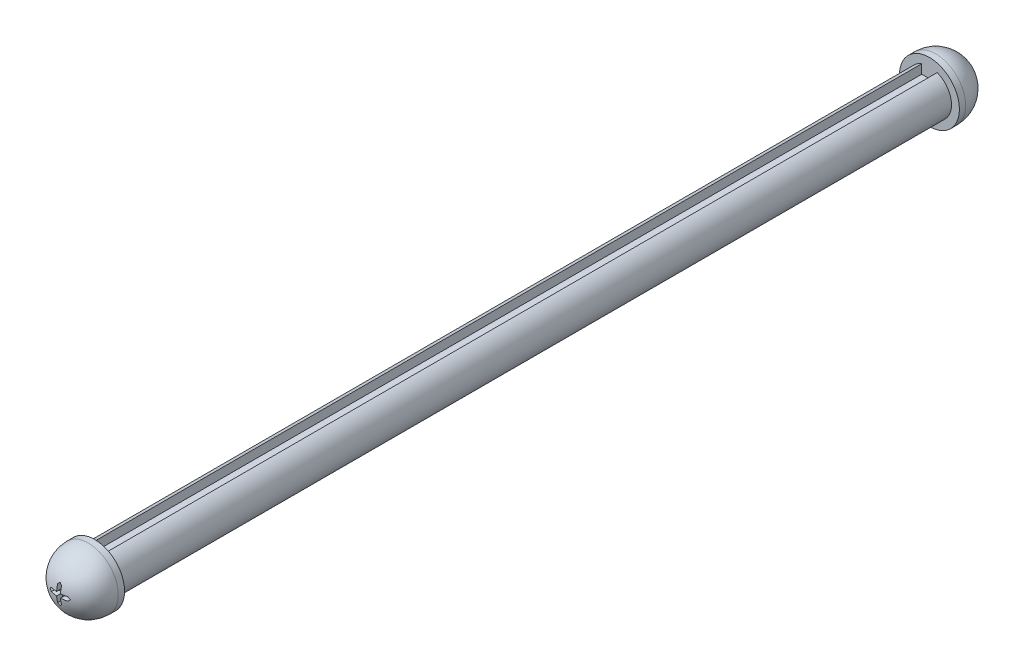
from build123d import *

# Parameters (mm, degrees)
BOSS_EXTRUDE1_DEPTH  = 132.4
SKETCH3_R            = 4.75
BOSS_EXTRUDE2_DEPTH  = 1
CUT_EXTRUDE1_DEPTH   = 1
CUT_EXTRUDE1_DRAFT   = 1
MIRROR1_COPY_1_DEPTH = 1
MIRROR1_COPY_1_DRAFT = 1


with BuildPart() as part:
    # Sketch2 → Boss-Extrude1 (new body)
    with BuildSketch(Plane.XY):
        with BuildLine():
            Line((-1.225, 1.828623949), (1.225, 1.828623949))
            Line((1.225, 1.828623949), (1.225, 3.278623949))
            ThreePointArc((1.225, 3.278623949), (0, -3.5), (-1.225, 3.278623949))
            Line((-1.225, 3.278623949), (-1.225, 1.828623949))
        make_face()
    extrude(amount=BOSS_EXTRUDE1_DEPTH)

    # Sketch3 → Boss-Extrude2 (add)
    with BuildSketch(Plane(origin=(0, 0, 0), x_dir=(-1, 0, 0), z_dir=(0, 0, -1))):
        Circle(SKETCH3_R)
    boss_extrude2 = extrude(amount=BOSS_EXTRUDE2_DEPTH)

    # Sketch4 → Revolve1 (revolve)
    with BuildSketch(Plane(origin=(0, 0, 0), x_dir=(1, 0, 0), z_dir=(0, 1, 0))):
        with BuildLine():
            Line((0, 1), (4.75, 1))
            ThreePointArc((4.75, 1), (3.358757211, 4.358757211), (0, 5.75))
            Line((0, 5.75), (0, 1))
        make_face()
    revolve1 = revolve(axis=Axis((0, 0, -5.75), (0, 0, 1)))


with BuildPart() as cut_extrude1_tool:
    # Sketch5 → Cut-Extrude1 (with draft: the straight prism first)
    with BuildSketch(Plane(origin=(0, 0, -5.75), x_dir=(-1, 0, 0), z_dir=(0, 0, -1))):
        Polygon((0, 1.6), (-0.3, 1.3), (-0.3, 0.3), (-1.3, 0.3), (-1.6, 0), (-1.3, -0.3), (-0.3, -0.3), (-0.3, -1.3), (0, -1.6), (0.3, -1.3), (0.3, -0.3), (1.3, -0.3), (1.6, 0), (1.3, 0.3), (0.3, 0.3), (0.3, 1.3), align=None)
    extrude(amount=-CUT_EXTRUDE1_DEPTH)
    # Cut-Extrude1: the draft: its side faces are tilted about the plane it starts from
    cut_extrude1_sides = [cut_extrude1_tool.faces().sort_by_distance(p)[0] for p in [
        (0.15, 1.45, -5.25),
        (0.3, 0.8, -5.25),
        (0.8, 0.3, -5.25),
        (1.45, 0.15, -5.25),
        (1.45, -0.15, -5.25),
        (0.8, -0.3, -5.25),
        (0.3, -0.8, -5.25),
        (0.15, -1.45, -5.25),
        (-0.15, -1.45, -5.25),
        (-0.3, -0.8, -5.25),
        (-0.8, -0.3, -5.25),
        (-1.45, -0.15, -5.25),
        (-1.45, 0.15, -5.25),
        (-0.8, 0.3, -5.25),
        (-0.3, 0.8, -5.25),
        (-0.15, 1.45, -5.25),
    ]]
    draft(cut_extrude1_sides, Plane(origin=(0, 0, -5.75), x_dir=(-1, 0, 0), z_dir=(0, 0, -1)), CUT_EXTRUDE1_DRAFT)


with BuildPart() as part_1:
    add(part.part)

    # Cut-Extrude1: cut by cut_extrude1_tool
    add(cut_extrude1_tool.part, mode=Mode.SUBTRACT)

    # Mirror1: Boss-Extrude2, Revolve1 across plane
    add(boss_extrude2.mirror(Plane.XY.offset(66.2)))
    add(revolve1.mirror(Plane.XY.offset(66.2)))


with BuildPart() as mirror1_copy_1_tool:
    # Mirror1 copy 1 sketch → Mirror1 copy 1 (with draft: the straight prism first)
    with BuildSketch(Plane(origin=(0, 0, 138.15), x_dir=(-1, 0, 0), z_dir=(0, 0, 1))):
        Polygon((0, -1.6), (-0.3, -1.3), (-0.3, -0.3), (-1.3, -0.3), (-1.6, 0), (-1.3, 0.3), (-0.3, 0.3), (-0.3, 1.3), (0, 1.6), (0.3, 1.3), (0.3, 0.3), (1.3, 0.3), (1.6, 0), (1.3, -0.3), (0.3, -0.3), (0.3, -1.3), align=None)
    extrude(amount=-MIRROR1_COPY_1_DEPTH)
    # Mirror1 copy 1: the draft: its side faces are tilted about the plane it starts from
    mirror1_copy_1_sides = [mirror1_copy_1_tool.faces().sort_by_distance(p)[0] for p in [
        (0.15, 1.45, 137.65),
        (0.3, 0.8, 137.65),
        (0.8, 0.3, 137.65),
        (1.45, 0.15, 137.65),
        (1.45, -0.15, 137.65),
        (0.8, -0.3, 137.65),
        (0.3, -0.8, 137.65),
        (0.15, -1.45, 137.65),
        (-0.15, -1.45, 137.65),
        (-0.3, -0.8, 137.65),
        (-0.8, -0.3, 137.65),
        (-1.45, -0.15, 137.65),
        (-1.45, 0.15, 137.65),
        (-0.8, 0.3, 137.65),
        (-0.3, 0.8, 137.65),
        (-0.15, 1.45, 137.65),
    ]]
    draft(mirror1_copy_1_sides, Plane(origin=(0, 0, 138.15), x_dir=(-1, 0, 0), z_dir=(0, 0, 1)), MIRROR1_COPY_1_DRAFT)


with BuildPart() as part_2:
    add(part_1.part)

    # Mirror1 copy 1: cut by mirror1_copy_1_tool
    add(mirror1_copy_1_tool.part, mode=Mode.SUBTRACT)


solid = part_2.part
